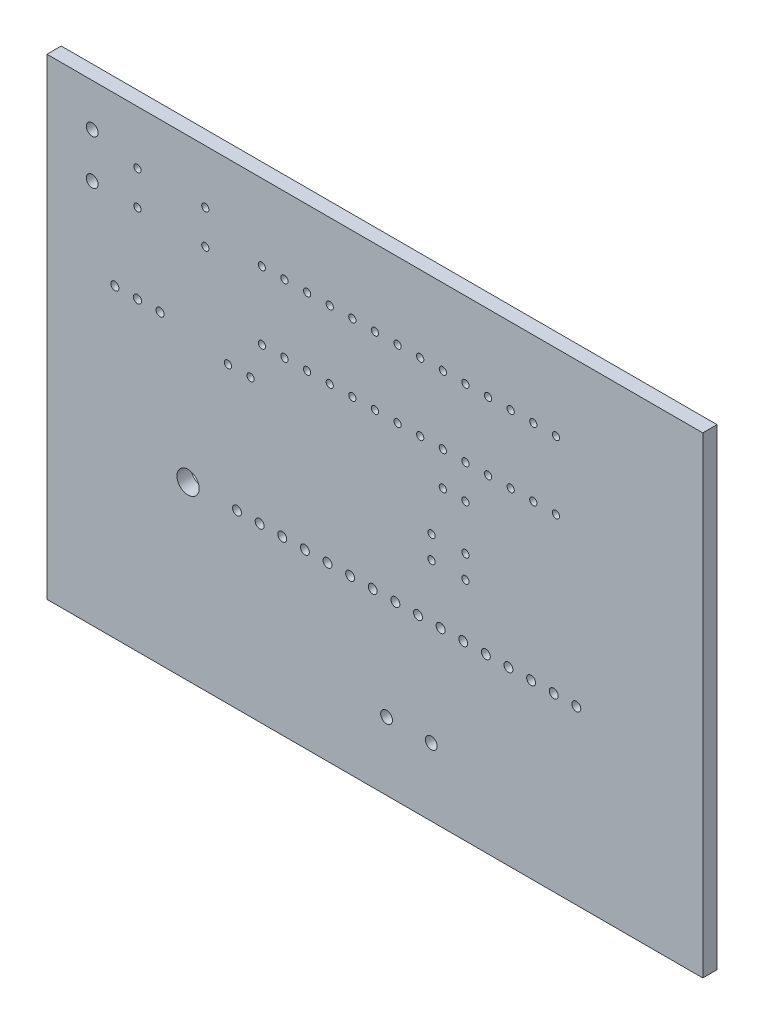
from build123d import *

# Parameters (mm, degrees)
SKETCH1_W           = 73.64
SKETCH1_H           = 53.01
BOARD_OUTLINE_DEPTH = 1.6
SKETCH2_R           = 1.25
NPTH_DEPTH          = 138.043199393
SKETCH3_R           = 0.405
SKETCH3_R_2         = 0.455
SKETCH3_R_3         = 0.5
SKETCH3_R_4         = 0.66
PTH_DEPTH           = 138.043199393


with BuildPart() as part:
    # Sketch1 → Board_Outline (new body)
    with BuildSketch(Plane.XY):
        with Locations((81.27, 43.015)):
            Rectangle(SKETCH1_W, SKETCH1_H)
    extrude(amount=BOARD_OUTLINE_DEPTH)

    # Sketch2 → NPTH (cut, through all)
    with BuildSketch(Plane.XY):
        with Locations((60.29, 4.82)):
            Circle(SKETCH2_R)
        with Locations((135.29, 4.82)):
            Circle(SKETCH2_R)
        with Locations((60.29, 35.82)):
            Circle(SKETCH2_R)
        with Locations((135.29, 35.82)):
            Circle(SKETCH2_R)
    extrude(amount=NPTH_DEPTH, mode=Mode.SUBTRACT)

    # Sketch3 → PTH (cut, through all)
    with BuildSketch(Plane.XY):
        with Locations((88.9, 49.53)):
            Circle(SKETCH3_R)
        with Locations((91.44, 49.53)):
            Circle(SKETCH3_R)
        with Locations((91.44, 41.91)):
            Circle(SKETCH3_R)
        with Locations((91.44, 44.45)):
            Circle(SKETCH3_R)
        with Locations((87.63, 41.91)):
            Circle(SKETCH3_R)
        with Locations((87.63, 44.45)):
            Circle(SKETCH3_R)
        with Locations((52.07, 50.8)):
            Circle(SKETCH3_R_2)
        with Locations((54.61, 50.8)):
            Circle(SKETCH3_R_2)
        with Locations((57.15, 50.8)):
            Circle(SKETCH3_R_2)
        with Locations((65.79, 35.82)):
            Circle(SKETCH3_R_3)
        with Locations((68.33, 35.82)):
            Circle(SKETCH3_R_3)
        with Locations((70.87, 35.82)):
            Circle(SKETCH3_R_3)
        with Locations((73.41, 35.82)):
            Circle(SKETCH3_R_3)
        with Locations((75.95, 35.82)):
            Circle(SKETCH3_R_3)
        with Locations((78.49, 35.82)):
            Circle(SKETCH3_R_3)
        with Locations((81.03, 35.82)):
            Circle(SKETCH3_R_3)
        with Locations((83.57, 35.82)):
            Circle(SKETCH3_R_3)
        with Locations((86.11, 35.82)):
            Circle(SKETCH3_R_3)
        with Locations((88.65, 35.82)):
            Circle(SKETCH3_R_3)
        with Locations((91.19, 35.82)):
            Circle(SKETCH3_R_3)
        with Locations((93.73, 35.82)):
            Circle(SKETCH3_R_3)
        with Locations((96.27, 35.82)):
            Circle(SKETCH3_R_3)
        with Locations((98.81, 35.82)):
            Circle(SKETCH3_R_3)
        with Locations((101.35, 35.82)):
            Circle(SKETCH3_R_3)
        with Locations((103.89, 35.82)):
            Circle(SKETCH3_R_3)
        with Locations((68.58, 53.34)):
            Circle(SKETCH3_R)
        with Locations((71.12, 53.34)):
            Circle(SKETCH3_R)
        with Locations((73.66, 53.34)):
            Circle(SKETCH3_R)
        with Locations((76.2, 53.34)):
            Circle(SKETCH3_R)
        with Locations((78.74, 53.34)):
            Circle(SKETCH3_R)
        with Locations((81.28, 53.34)):
            Circle(SKETCH3_R)
        with Locations((83.82, 53.34)):
            Circle(SKETCH3_R)
        with Locations((86.36, 53.34)):
            Circle(SKETCH3_R)
        with Locations((88.9, 53.34)):
            Circle(SKETCH3_R)
        with Locations((91.44, 53.34)):
            Circle(SKETCH3_R)
        with Locations((93.98, 53.34)):
            Circle(SKETCH3_R)
        with Locations((96.52, 53.34)):
            Circle(SKETCH3_R)
        with Locations((99.06, 53.34)):
            Circle(SKETCH3_R)
        with Locations((101.6, 53.34)):
            Circle(SKETCH3_R)
        with Locations((101.6, 60.96)):
            Circle(SKETCH3_R)
        with Locations((99.06, 60.96)):
            Circle(SKETCH3_R)
        with Locations((96.52, 60.96)):
            Circle(SKETCH3_R)
        with Locations((93.98, 60.96)):
            Circle(SKETCH3_R)
        with Locations((91.44, 60.96)):
            Circle(SKETCH3_R)
        with Locations((88.9, 60.96)):
            Circle(SKETCH3_R)
        with Locations((86.36, 60.96)):
            Circle(SKETCH3_R)
        with Locations((83.82, 60.96)):
            Circle(SKETCH3_R)
        with Locations((81.28, 60.96)):
            Circle(SKETCH3_R)
        with Locations((78.74, 60.96)):
            Circle(SKETCH3_R)
        with Locations((76.2, 60.96)):
            Circle(SKETCH3_R)
        with Locations((73.66, 60.96)):
            Circle(SKETCH3_R)
        with Locations((71.12, 60.96)):
            Circle(SKETCH3_R)
        with Locations((68.58, 60.96)):
            Circle(SKETCH3_R)
        with Locations((54.61, 63.5)):
            Circle(SKETCH3_R)
        with Locations((62.23, 63.5)):
            Circle(SKETCH3_R)
        with Locations((62.23, 59.69)):
            Circle(SKETCH3_R)
        with Locations((54.61, 59.69)):
            Circle(SKETCH3_R)
        with Locations((67.31, 49.53)):
            Circle(SKETCH3_R)
        with Locations((64.77, 49.53)):
            Circle(SKETCH3_R)
        with Locations((49.53, 64.74)):
            Circle(SKETCH3_R_4)
        with Locations((49.53, 59.72)):
            Circle(SKETCH3_R_4)
        with Locations((87.6, 24.13)):
            Circle(SKETCH3_R_4)
        with Locations((82.58, 24.13)):
            Circle(SKETCH3_R_4)
    extrude(amount=PTH_DEPTH, mode=Mode.SUBTRACT)


solid = part.part
